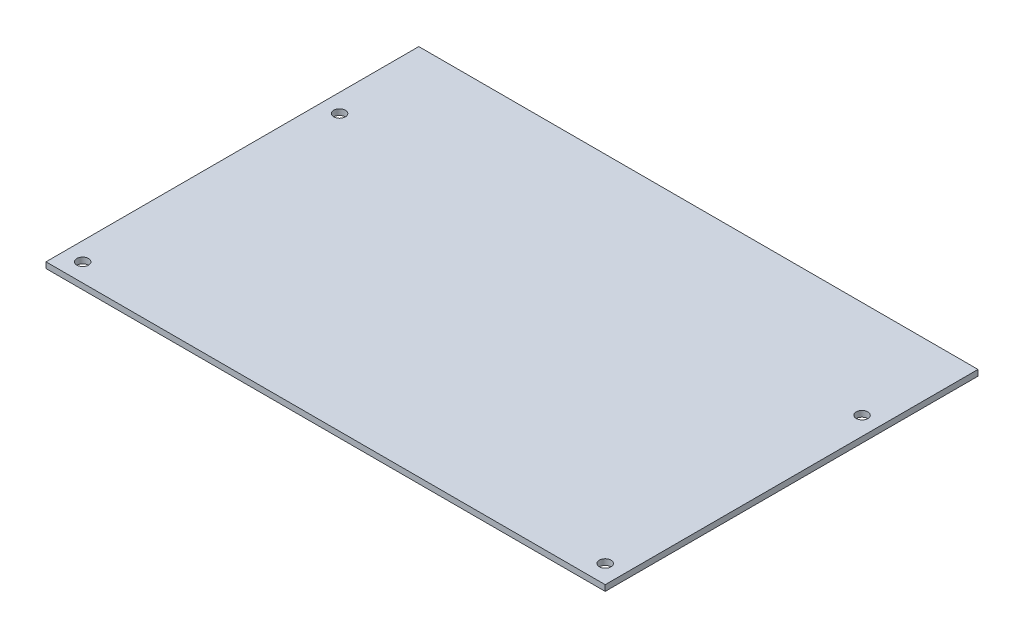
from build123d import *

# Parameters (mm, degrees)
SKETCH1_W           = 152.4
SKETCH1_H           = 101.6
BOSS_EXTRUDE1_DEPTH = 1.6
SKETCH3_R           = 1.5875
CUT_EXTRUDE1_DEPTH  = 92.594978028


with BuildPart() as part:
    # Sketch1 → Boss-Extrude1 (new body)
    with BuildSketch(Plane(origin=(0, 0, 0), x_dir=(1, 0, 0), z_dir=(0, 1, 0))):
        Rectangle(SKETCH1_W, SKETCH1_H)
    extrude(amount=BOSS_EXTRUDE1_DEPTH)

    # Sketch3 → Cut-Extrude1 (cut, through all)
    with BuildSketch(Plane.XZ):
        with Locations(Location((-71.2, 45.8, 0), (0, 0, 270))):
            Circle(SKETCH3_R)
        with Locations(Location((-71.2, -24.2, 0), (0, 0, 270))):
            Circle(SKETCH3_R)
        with Locations(Location((71.2, -24.2, 0), (0, 0, 270))):
            Circle(SKETCH3_R)
        with Locations(Location((71.2, 45.8, 0), (0, 0, 270))):
            Circle(SKETCH3_R)
    extrude(amount=-CUT_EXTRUDE1_DEPTH, mode=Mode.SUBTRACT)


solid = part.part
